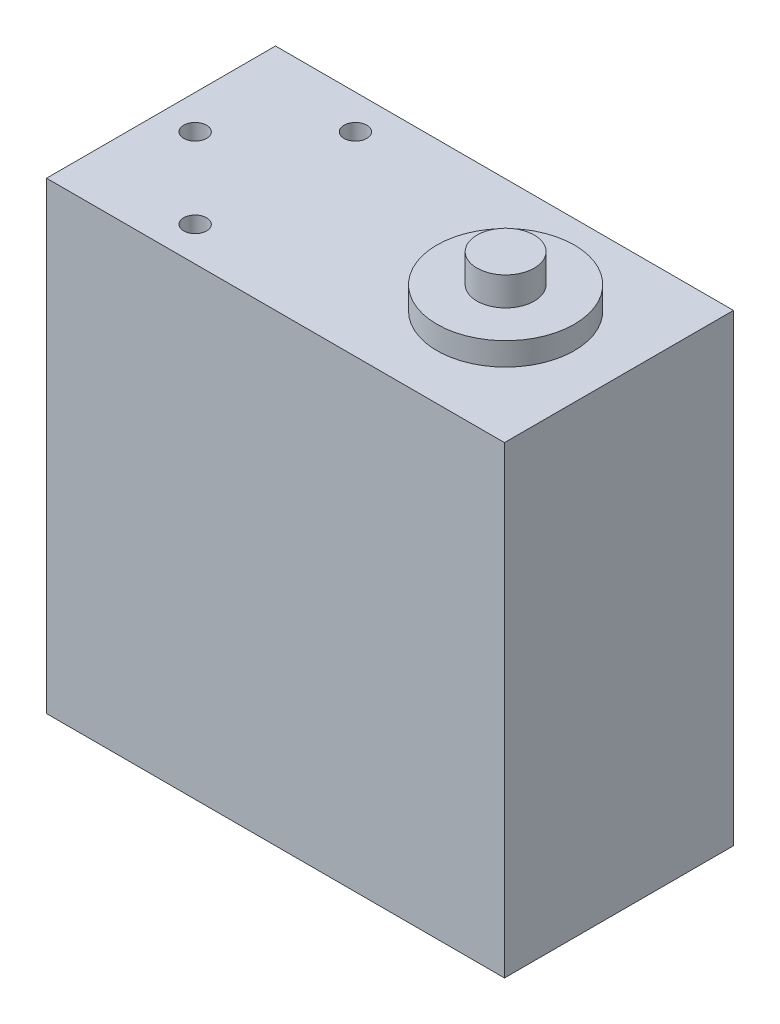
from build123d import *

# Parameters (mm, degrees)
SKETCH_1_W          = 40
SKETCH_1_H          = 40.5
EXTRUDE_1_DEPTH     = 20
SKETCH_2_R          = 6
EXTRUDE_2_DEPTH     = 2
SKETCH_4_R          = 2.5
EXTRUDE_3_DEPTH     = 2.5
EXTRUDE_START       = 2.5
SKETCH_5_R          = 2.5
EXTRUDE_4_DEPTH     = 2.5
SKETCH_6_R          = 1
CUT_EXTRUDE_1_DEPTH = 2.5
SKETCH_7_R          = 1
CUT_EXTRUDE_2_DEPTH = 2.5


with BuildPart() as part:
    # 草图1 → 凸台-拉伸1 (new body)
    with BuildSketch(Plane.XY):
        with Locations((20, 20.25)):
            Rectangle(SKETCH_1_W, SKETCH_1_H)
    extrude(amount=EXTRUDE_1_DEPTH)

    # 草图2 → 凸台-拉伸2 (add)
    with BuildSketch(Plane(origin=(0, 40.5, 0), x_dir=(1, 0, 0), z_dir=(0, 1, 0))):
        with Locations(Location((30.1, -10, 0), (0, 0, 90))):
            Circle(SKETCH_2_R)
    extrude_2 = extrude(amount=EXTRUDE_2_DEPTH)

    # 镜向1: 凸台-拉伸2 across plane
    add(extrude_2.mirror(Plane.ZX.offset(20.25)))

    # 草图4 → 凸台-拉伸3 (add)
    with BuildSketch(Plane(origin=(0, 42.5, 0), x_dir=(1, 0, 0), z_dir=(0, 1, 0))):
        with Locations(Location((30.1, -10, 0), (0, 0, 270))):
            Circle(SKETCH_4_R)
    extrude(amount=EXTRUDE_3_DEPTH)

    # 草图5 → 凸台-拉伸4 (add)
    with BuildSketch(Plane.XZ.offset(2).offset(EXTRUDE_START)):
        with Locations(Location((30.1, 10, 0), (0, 0, 90))):
            Circle(SKETCH_5_R)
    extrude(amount=-EXTRUDE_4_DEPTH)

    # 草图6 → 切除-拉伸1 (cut)
    with BuildSketch(Plane(origin=(0, 40.5, 0), x_dir=(1, 0, 0), z_dir=(0, 1, 0))):
        with Locations(Location((9.98, -3, 0), (0, 0, 270))):
            Circle(SKETCH_6_R)
        with Locations(Location((9.98, -17, 0), (0, 0, 270))):
            Circle(SKETCH_6_R)
        with Locations(Location((2.98, -10, 0), (0, 0, 270))):
            Circle(SKETCH_6_R)
    extrude(amount=-CUT_EXTRUDE_1_DEPTH, mode=Mode.SUBTRACT)

    # 草图7 → 切除-拉伸2 (cut)
    with BuildSketch(Plane.XZ):
        with Locations(Location((2.5, 17.5, 0), (0, 0, 270))):
            Circle(SKETCH_7_R)
        with Locations(Location((17.5, 17.5, 0), (0, 0, 270))):
            Circle(SKETCH_7_R)
        with Locations(Location((17.5, 2.5, 0), (0, 0, 270))):
            Circle(SKETCH_7_R)
        with Locations(Location((2.5, 2.5, 0), (0, 0, 270))):
            Circle(SKETCH_7_R)
    extrude(amount=-CUT_EXTRUDE_2_DEPTH, mode=Mode.SUBTRACT)


solid = part.part
